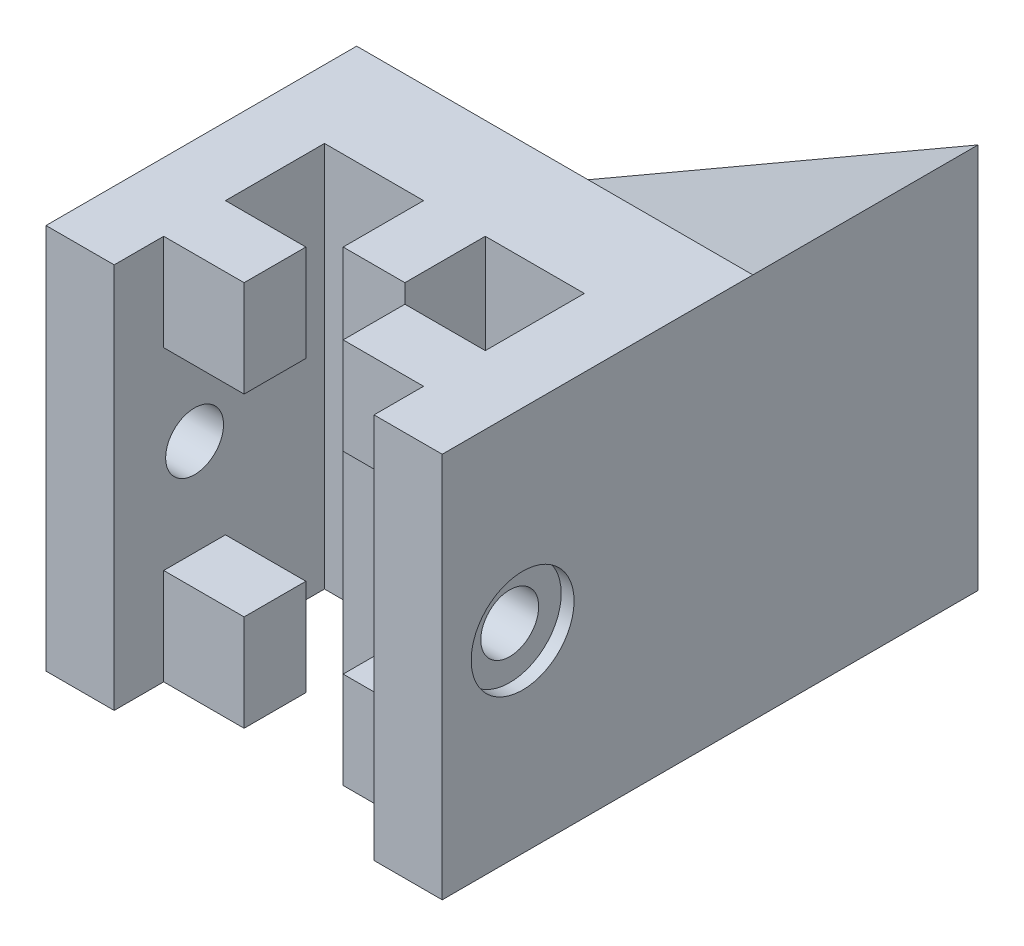
from build123d import *

# Parameters (mm, degrees)
BOSS_EXTRU_1_DEPTH                                = 15
ESQUISSE2_W                                       = 30.8
ESQUISSE2_H                                       = 30
BOSS_EXTRU_2_DEPTH                                = 20
ENL_V_MAT_EXTRU_2_DEPTH                           = 47.870913155
ENL_V_MAT_EXTRU_2_DEPTH_BACK                      = 17.5
ESQUISSE4_W                                       = 4.8
ESQUISSE4_H                                       = 15
ENL_V_MAT_EXTRU_3_DEPTH                           = 6.25
ESQUISSE5_W                                       = 4.8
ESQUISSE5_H                                       = 15
ENL_V_MAT_EXTRU_4_DEPTH                           = 6.25
CHAMBRAGE_POUR_VIS_SIX_PANS_CREUX_M41_D           = 4.5
CHAMBRAGE_POUR_VIS_SIX_PANS_CREUX_M41_DEPTH       = 5.3
CHAMBRAGE_POUR_VIS_SIX_PANS_CREUX_M41_CBORE_D     = 8
CHAMBRAGE_POUR_VIS_SIX_PANS_CREUX_M41_CBORE_DEPTH = 1
CHAMBRAGE_POUR_VIS_SIX_PANS_CREUX_M43_D           = 4.5
CHAMBRAGE_POUR_VIS_SIX_PANS_CREUX_M43_CBORE_D     = 8
CHAMBRAGE_POUR_VIS_SIX_PANS_CREUX_M43_CBORE_DEPTH = 1


with BuildPart() as part:
    # Base → Boss.-Extru.1 (new, symmetric)
    with BuildSketch(Plane(origin=(0, 0, 0), x_dir=(1, 0, 0), z_dir=(0, 1, 0))):
        Polygon((-3.85, -2.4), (-3.85, 2.4), (-10.1, 2.4), (-10.1, 10.1), (-2.4, 10.1), (-2.4, 3.85), (2.4, 3.85), (2.4, 10.1), (10.1, 10.1), (10.1, 2.4), (3.85, 2.4), (3.85, -2.4), (10.1, -2.4), (10.1, -6.25), (15.4, -6.25), (15.4, 15.4), (-15.4, 15.4), (-15.4, -6.25), (-10.1, -6.25), (-10.1, -2.4), align=None)
    extrude(amount=BOSS_EXTRU_1_DEPTH, both=True)

    # Esquisse2 → Boss.-Extru.2 (add)
    with BuildSketch(Plane(origin=(0, 0, -15.4), x_dir=(-1, 0, 0), z_dir=(0, 0, -1))):
        Rectangle(ESQUISSE2_W, ESQUISSE2_H)
    extrude(amount=BOSS_EXTRU_2_DEPTH)

    # Esquisse3 → Enlèv. mat.-Extru.2 (cut, two sides: drawn at the far end of the back side and taken through both)
    with BuildSketch(Plane(origin=(0, 0, -35.4), x_dir=(-1, 0, 0), z_dir=(0, 0, -1)).offset(-ENL_V_MAT_EXTRU_2_DEPTH_BACK)):
        Polygon((-98.531187965, 62.99581375), (-15.4, 15), (15.4, -2.782388291), (98.531187965, -50.778202041), (194.522815465, 115.484173889), (-2.539560466, 229.25818968), align=None)
    extrude(amount=ENL_V_MAT_EXTRU_2_DEPTH + ENL_V_MAT_EXTRU_2_DEPTH_BACK, mode=Mode.SUBTRACT)

    # Esquisse4 → Enlèv. mat.-Extru.3 (cut)
    with BuildSketch(Plane.ZY.offset(-3.85)):
        Rectangle(ESQUISSE4_W, ESQUISSE4_H)
    extrude(amount=-ENL_V_MAT_EXTRU_3_DEPTH, mode=Mode.SUBTRACT)

    # Esquisse5 → Enlèv. mat.-Extru.4 (cut)
    with BuildSketch(Plane(origin=(-3.85, 0, 0), x_dir=(0, 0, -1), z_dir=(1, 0, 0))):
        Rectangle(ESQUISSE5_W, ESQUISSE5_H)
    extrude(amount=-ENL_V_MAT_EXTRU_4_DEPTH, mode=Mode.SUBTRACT)

    # Chambrage pour vis à six pans creux M41
    with Locations(Plane(origin=(15.4, 0, 0), x_dir=(0, 0, -1), z_dir=(1, 0, 0))):
        with Locations((0, 0)):
            CounterBoreHole(CHAMBRAGE_POUR_VIS_SIX_PANS_CREUX_M41_D / 2, CHAMBRAGE_POUR_VIS_SIX_PANS_CREUX_M41_CBORE_D / 2, CHAMBRAGE_POUR_VIS_SIX_PANS_CREUX_M41_CBORE_DEPTH, depth=CHAMBRAGE_POUR_VIS_SIX_PANS_CREUX_M41_DEPTH)

    # Chambrage pour vis à six pans creux M43 (through all)
    with Locations(Plane.ZY.offset(15.4)):
        with Locations((0, 0)):
            CounterBoreHole(CHAMBRAGE_POUR_VIS_SIX_PANS_CREUX_M43_D / 2, CHAMBRAGE_POUR_VIS_SIX_PANS_CREUX_M43_CBORE_D / 2, CHAMBRAGE_POUR_VIS_SIX_PANS_CREUX_M43_CBORE_DEPTH)


solid = part.part
